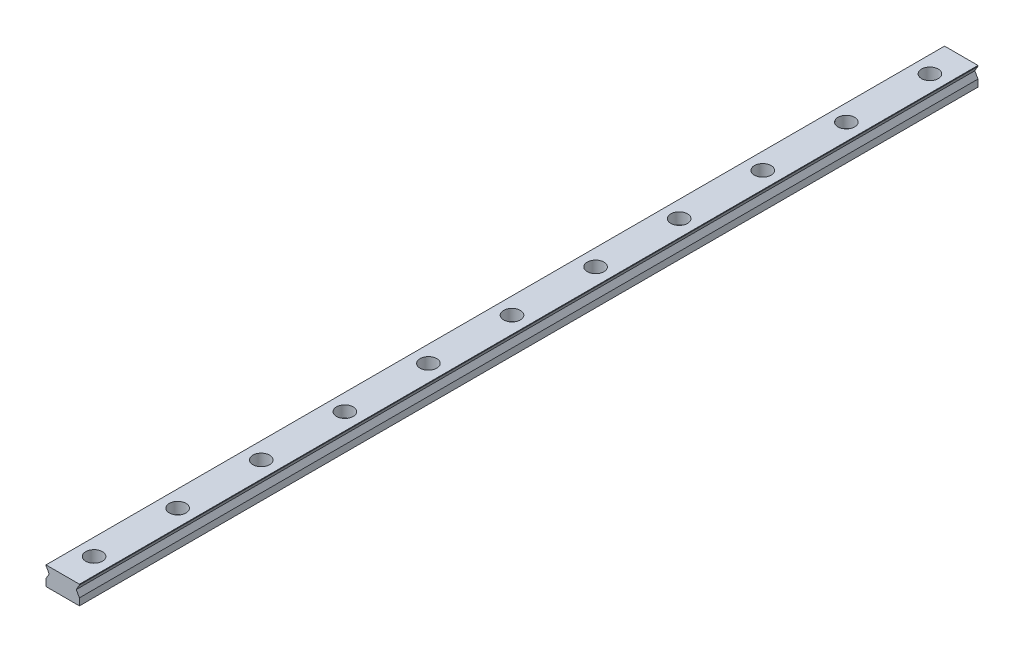
from build123d import *

# Parameters (mm, degrees)
BOSS_EXTRUDE1_DEPTH = 430


with BuildPart() as part:
    # Sketch1 → Boss-Extrude1 (new body)
    with BuildSketch(Plane.XY):
        Polygon((-8, 0), (8, 0), (8, 3.35), (6.47, 6), (8, 8.65), (8, 9), (-8, 9), (-8, 8.65), (-6.47, 6), (-8, 3.35), align=None)
    extrude(amount=BOSS_EXTRUDE1_DEPTH)

    # Sketch2 → Cut-Revolve1 (revolve, cut)
    with BuildSketch(Plane.XY.offset(15), mode=Mode.PRIVATE) as cut_revolve1_sk:
        Polygon((0, 9), (4, 9), (4, 3.5), (2.25, 3.5), (2.25, 0), (0, 0), align=None)
    revolve(cut_revolve1_sk.sketch.rotate(Axis((0, 0, 15), (0, 1, 0)), 270), axis=Axis((0, 0, 15), (0, 1, 0)), mode=Mode.SUBTRACT)

    # Sketch3 → Cut-Revolve2 (revolve, cut)
    with BuildSketch(Plane.XY.offset(55), mode=Mode.PRIVATE) as cut_revolve2_sk:
        Polygon((0, 9), (4, 9), (4, 3.5), (2.25, 3.5), (2.25, 0), (0, 0), align=None)
    revolve(cut_revolve2_sk.sketch.rotate(Axis((0, 0, 55), (0, 1, 0)), 270), axis=Axis((0, 0, 55), (0, 1, 0)), mode=Mode.SUBTRACT)

    # Sketch4 → Cut-Revolve3 (revolve, cut)
    with BuildSketch(Plane.XY.offset(95), mode=Mode.PRIVATE) as cut_revolve3_sk:
        Polygon((0, 9), (4, 9), (4, 3.5), (2.25, 3.5), (2.25, 0), (0, 0), align=None)
    revolve(cut_revolve3_sk.sketch.rotate(Axis((0, 0, 95), (0, 1, 0)), 270), axis=Axis((0, 0, 95), (0, 1, 0)), mode=Mode.SUBTRACT)

    # Sketch5 → Cut-Revolve4 (revolve, cut)
    with BuildSketch(Plane.XY.offset(135), mode=Mode.PRIVATE) as cut_revolve4_sk:
        Polygon((0, 9), (4, 9), (4, 3.5), (2.25, 3.5), (2.25, 0), (0, 0), align=None)
    revolve(cut_revolve4_sk.sketch.rotate(Axis((0, 0, 135), (0, 1, 0)), 270), axis=Axis((0, 0, 135), (0, 1, 0)), mode=Mode.SUBTRACT)

    # Sketch6 → Cut-Revolve5 (revolve, cut)
    with BuildSketch(Plane.XY.offset(175), mode=Mode.PRIVATE) as cut_revolve5_sk:
        Polygon((0, 9), (4, 9), (4, 3.5), (2.25, 3.5), (2.25, 0), (0, 0), align=None)
    revolve(cut_revolve5_sk.sketch.rotate(Axis((0, 0, 175), (0, 1, 0)), 270), axis=Axis((0, 0, 175), (0, 1, 0)), mode=Mode.SUBTRACT)

    # Sketch7 → Cut-Revolve6 (revolve, cut)
    with BuildSketch(Plane.XY.offset(215), mode=Mode.PRIVATE) as cut_revolve6_sk:
        Polygon((0, 9), (4, 9), (4, 3.5), (2.25, 3.5), (2.25, 0), (0, 0), align=None)
    revolve(cut_revolve6_sk.sketch.rotate(Axis((0, 0, 215), (0, 1, 0)), 270), axis=Axis((0, 0, 215), (0, 1, 0)), mode=Mode.SUBTRACT)

    # Sketch8 → Cut-Revolve7 (revolve, cut)
    with BuildSketch(Plane.XY.offset(255), mode=Mode.PRIVATE) as cut_revolve7_sk:
        Polygon((0, 9), (4, 9), (4, 3.5), (2.25, 3.5), (2.25, 0), (0, 0), align=None)
    revolve(cut_revolve7_sk.sketch.rotate(Axis((0, 0, 255), (0, 1, 0)), 270), axis=Axis((0, 0, 255), (0, 1, 0)), mode=Mode.SUBTRACT)

    # Sketch9 → Cut-Revolve8 (revolve, cut)
    with BuildSketch(Plane.XY.offset(295), mode=Mode.PRIVATE) as cut_revolve8_sk:
        Polygon((0, 9), (4, 9), (4, 3.5), (2.25, 3.5), (2.25, 0), (0, 0), align=None)
    revolve(cut_revolve8_sk.sketch.rotate(Axis((0, 0, 295), (0, 1, 0)), 270), axis=Axis((0, 0, 295), (0, 1, 0)), mode=Mode.SUBTRACT)

    # Sketch10 → Cut-Revolve9 (revolve, cut)
    with BuildSketch(Plane.XY.offset(335), mode=Mode.PRIVATE) as cut_revolve9_sk:
        Polygon((0, 9), (4, 9), (4, 3.5), (2.25, 3.5), (2.25, 0), (0, 0), align=None)
    revolve(cut_revolve9_sk.sketch.rotate(Axis((0, 0, 335), (0, 1, 0)), 270), axis=Axis((0, 0, 335), (0, 1, 0)), mode=Mode.SUBTRACT)

    # Sketch11 → Cut-Revolve10 (revolve, cut)
    with BuildSketch(Plane.XY.offset(375), mode=Mode.PRIVATE) as cut_revolve10_sk:
        Polygon((0, 9), (4, 9), (4, 3.5), (2.25, 3.5), (2.25, 0), (0, 0), align=None)
    revolve(cut_revolve10_sk.sketch.rotate(Axis((0, 0, 375), (0, 1, 0)), 270), axis=Axis((0, 0, 375), (0, 1, 0)), mode=Mode.SUBTRACT)

    # Sketch12 → Cut-Revolve11 (revolve, cut)
    with BuildSketch(Plane.XY.offset(415), mode=Mode.PRIVATE) as cut_revolve11_sk:
        Polygon((0, 9), (4, 9), (4, 3.5), (2.25, 3.5), (2.25, 0), (0, 0), align=None)
    revolve(cut_revolve11_sk.sketch.rotate(Axis((0, 0, 415), (0, 1, 0)), 270), axis=Axis((0, 0, 415), (0, 1, 0)), mode=Mode.SUBTRACT)


solid = part.part
